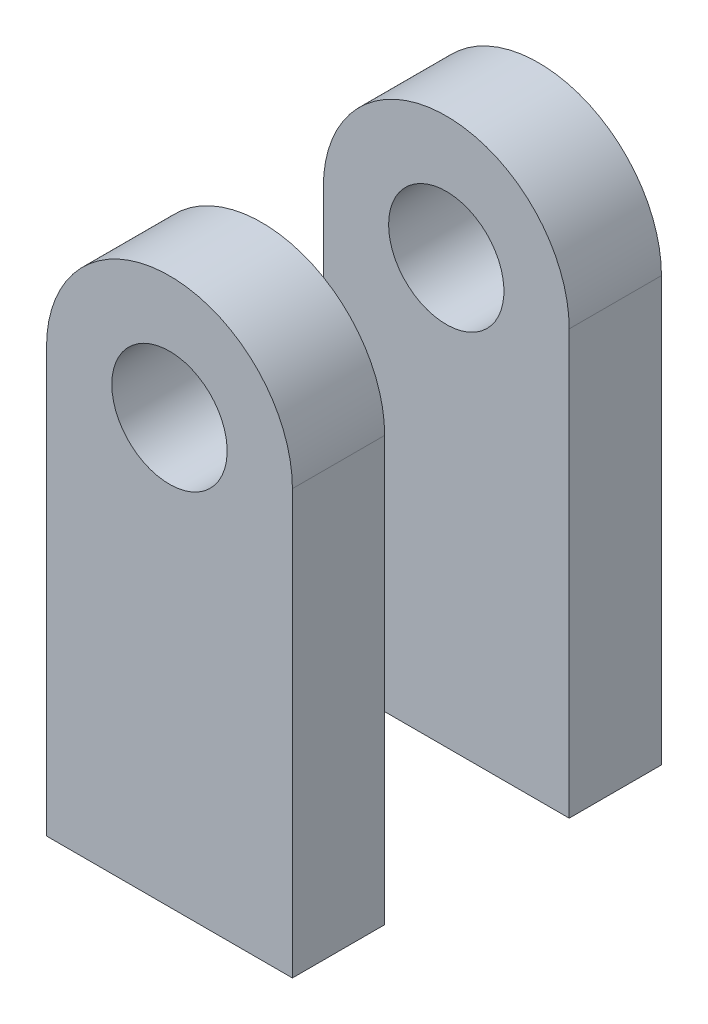
from build123d import *

# Parameters (mm, degrees)
SKETCH1_R           = 2.38125
BOSS_EXTRUDE1_DEPTH = 7.62
SKETCH2_W           = 7.62
SKETCH2_H           = 24.17124054
CUT_EXTRUDE1_DEPTH  = 25.4
SKETCH3_W           = 10.153313745
SKETCH3_H           = 3.81
BOSS_EXTRUDE2_DEPTH = 11.15


with BuildPart() as part:
    # Sketch1 → Boss-Extrude1 (new, symmetric)
    with BuildSketch(Plane.XY):
        with BuildLine():
            Line((0, 6.35), (0, 0))
            Line((0, 0), (10.153313745, 0))
            Line((10.153313745, 0), (10.153313745, 6.35))
            ThreePointArc((10.153313745, 6.35), (5.076656873, 11.426656873), (0, 6.35))
        make_face()
        with Locations((5.076656873, 6.35)):
            Circle(SKETCH1_R, mode=Mode.SUBTRACT)
    extrude(amount=BOSS_EXTRUDE1_DEPTH, both=True)

    # Sketch2 → Cut-Extrude1 (cut)
    with BuildSketch(Plane.ZY):
        with Locations((0, 12.08562027)):
            Rectangle(SKETCH2_W, SKETCH2_H)
    extrude(amount=-CUT_EXTRUDE1_DEPTH, mode=Mode.SUBTRACT)


with BuildPart() as cut_extrude1_piece_1:
    # of the separate pieces the step leaves, piece 1, a body of its own (cut_extrude1_pieces)
    add(part.part.solids().sort_by_distance((10.153313745, 6.35, -3.81))[0])



with BuildPart() as cut_extrude1_piece_2:
    # of the separate pieces the step leaves, piece 2, a body of its own (cut_extrude1_pieces)
    add(part.part.solids().sort_by_distance((10.153313745, 6.35, 7.62))[0])


with BuildPart() as cut_extrude1_piece_1_1:
    add(cut_extrude1_piece_1.part)

    add(cut_extrude1_piece_2.part)  # Boss-Extrude2 merges Cut-Extrude1 piece 2
    # Sketch3 → Boss-Extrude2 (add)
    with BuildSketch(Plane.XZ):
        with Locations((5.076656873, 5.715)):
            Rectangle(SKETCH3_W, SKETCH3_H)
        with Locations((5.076656873, -5.715)):
            Rectangle(SKETCH3_W, SKETCH3_H)
    extrude(amount=BOSS_EXTRUDE2_DEPTH)


solid = cut_extrude1_piece_1_1.part
